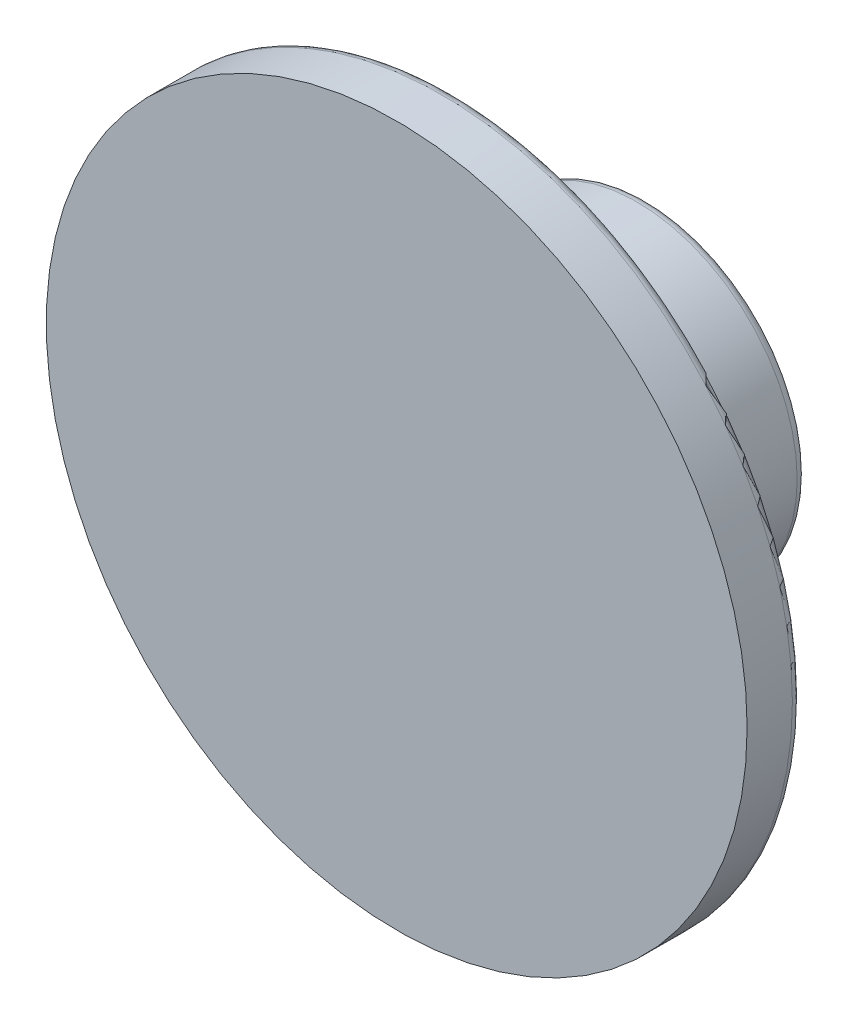
from build123d import *

# Parameters (mm, degrees)
FILLET1_R = 1


with BuildPart() as part:
    # Sketch1 → Revolve1 (revolve)
    with BuildSketch(Plane(origin=(0, 0, 0), x_dir=(1, 0, 0), z_dir=(0, 1, 0)), mode=Mode.PRIVATE) as revolve1_sk:
        with BuildLine():
            Line((0, 0), (-35, 0))
            Line((-35, 0), (-35, 5.5))
            ThreePointArc((-35, 5.5), (-24.378677107, 8.007354214), (-16, 15))
            Line((-16, 15), (-16, 25))
            Line((-16, 25), (-6, 25))
            Line((-6, 25), (-6, 15))
            Line((-6, 15), (0, 15))
            Line((0, 15), (0, 0))
        make_face()
    revolve(revolve1_sk.sketch.rotate(Axis((0, 0, 0), (0, 0, -1)), 180), axis=Axis((0, 0, 0), (0, 0, -1)))

    # Fillet1
    fillet1_edges = [part.edges().sort_by_distance(p)[0] for p in [
        (-35, 0, -5.5),
        (-16, 0, -15),
        (-16, 0, -25),
    ]]
    fillet(fillet1_edges, radius=FILLET1_R)


solid = part.part
